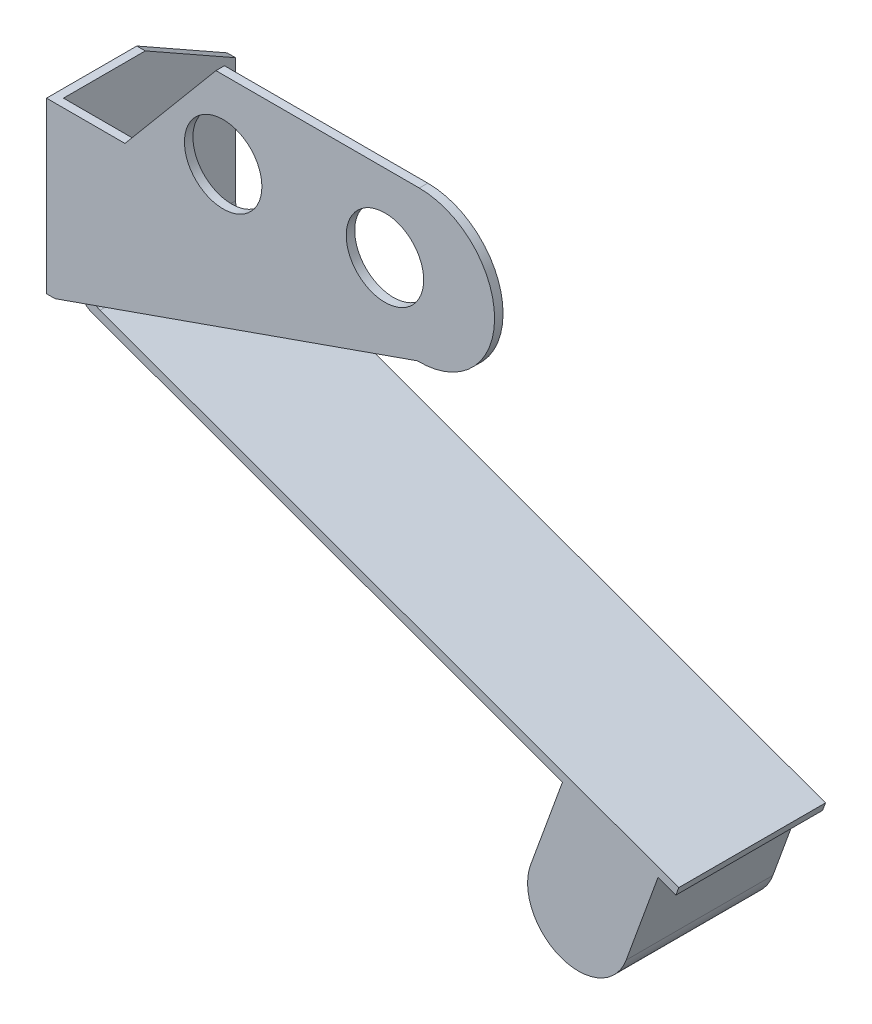
from build123d import *

# Parameters (mm, degrees)
EXTRUDE_1_DEPTH     = 5.33
SKETCH_3_W          = 18.524948115
SKETCH_3_H          = 1
CUT_EXTRUDE_2_DEPTH = 8
SKETCH_4_R          = 1.143
CUT_EXTRUDE_3_DEPTH = 8
SKETCH_5_W          = 14.906487706
SKETCH_5_H          = 5.08
CUT_EXTRUDE_4_DEPTH = 8.5
FILLET_1_R          = 0.5
SKETCH_6_W          = 1
SKETCH_6_H          = 0.794629951
CUT_EXTRUDE_5_DEPTH = 8.5
CUT_EXTRUDE_6_DEPTH = 8.5


with BuildPart() as part:
    # Эскиз1 → Бобышка-Вытянуть1 (new body)
    with BuildSketch(Plane.XY):
        with BuildLine():
            Line((-3.73172272, 3.969749711), (2.26827728, 3.969749711))
            ThreePointArc((2.26827728, 3.969749711), (4.49077728, 1.719238545), (2.212607957, -0.474901673))
            Line((2.212607957, -0.474901673), (-8.48172272, -4.233380934))
            Line((-8.48172272, -4.233380934), (-8.48172272, -4.745198404))
            Line((-8.48172272, -4.745198404), (8.926034324, -11.081103814))
            Line((8.926034324, -11.081103814), (8.840529289, -11.316026969))
            Line((8.840529289, -11.316026969), (8.31500946, -11.124753394))
            Line((8.31500946, -11.124753394), (7.374454066, -13.708908101))
            ThreePointArc((7.374454066, -13.708908101), (5.45188492, -14.605416817), (4.555376204, -12.682847671))
            Line((4.555376204, -12.682847671), (5.495931598, -10.098692964))
            Line((5.495931598, -10.098692964), (-8.73172272, -4.920250289))
            Line((-8.73172272, -4.920250289), (-8.73172272, 0.766619066))
            Line((-8.73172272, 0.766619066), (-6.416304518, 0.766619066))
            Line((-6.416304518, 0.766619066), (-3.73172272, 3.969749711))
        make_face()
    extrude(amount=EXTRUDE_1_DEPTH)

    # Эскиз3 → Вырез-Вытянуть2 (cut)
    with BuildSketch(Plane(origin=(-2.517250451, -6.916088773, 0), x_dir=(0.9396926207859082, -0.34202014332566943, 0), z_dir=(0.34202014332566943, 0.9396926207859082, 0))):
        with Locations((2.915215245, -4.83)):
            Rectangle(SKETCH_3_W, SKETCH_3_H)
    extrude(amount=-CUT_EXTRUDE_2_DEPTH, mode=Mode.SUBTRACT)

    # Эскиз4 → Вырез-Вытянуть3 (cut)
    with BuildSketch(Plane.XY.offset(5.33)):
        with Locations((-3.51932272, 1.683749711)):
            Circle(SKETCH_4_R)
        with Locations((1.25587728, 1.683749711)):
            Circle(SKETCH_4_R)
    extrude(amount=-CUT_EXTRUDE_3_DEPTH, mode=Mode.SUBTRACT)

    # Эскиз5 → Вырез-Вытянуть4 (cut)
    with BuildSketch(Plane(origin=(0, 3.969749711, 0), x_dir=(1, 0, 0), z_dir=(0, 1, 0))):
        with Locations((-1.028478867, -2.54)):
            Rectangle(SKETCH_5_W, SKETCH_5_H)
    extrude(amount=-CUT_EXTRUDE_4_DEPTH, mode=Mode.SUBTRACT)

    # Скругление1
    fillet_1_edges = [part.edges().sort_by_distance(p)[0] for p in [
        (-8.48172272, -4.745198404, 2.165),
        (-8.73172272, -4.920250289, 2.665),
    ]]
    fillet(fillet_1_edges, radius=FILLET_1_R)

    # Эскиз6 → Вырез-Вытянуть5 (cut)
    with BuildSketch(Plane(origin=(-8.48172272, 0, 0), x_dir=(0, 0, -1), z_dir=(1, 0, 0))):
        with Locations((-4.83, -4.630695909)):
            Rectangle(SKETCH_6_W, SKETCH_6_H)
    extrude(amount=-CUT_EXTRUDE_5_DEPTH, mode=Mode.SUBTRACT)

    # Эскиз7 → Вырез-Вытянуть6 (cut)
    with BuildSketch(Plane.ZY.offset(8.73172272)):
        Polygon((2.665, 0.766619066), (0, -0.740228), (0, 0.766619066), align=None)
    extrude(amount=-CUT_EXTRUDE_6_DEPTH, mode=Mode.SUBTRACT)


solid = part.part
